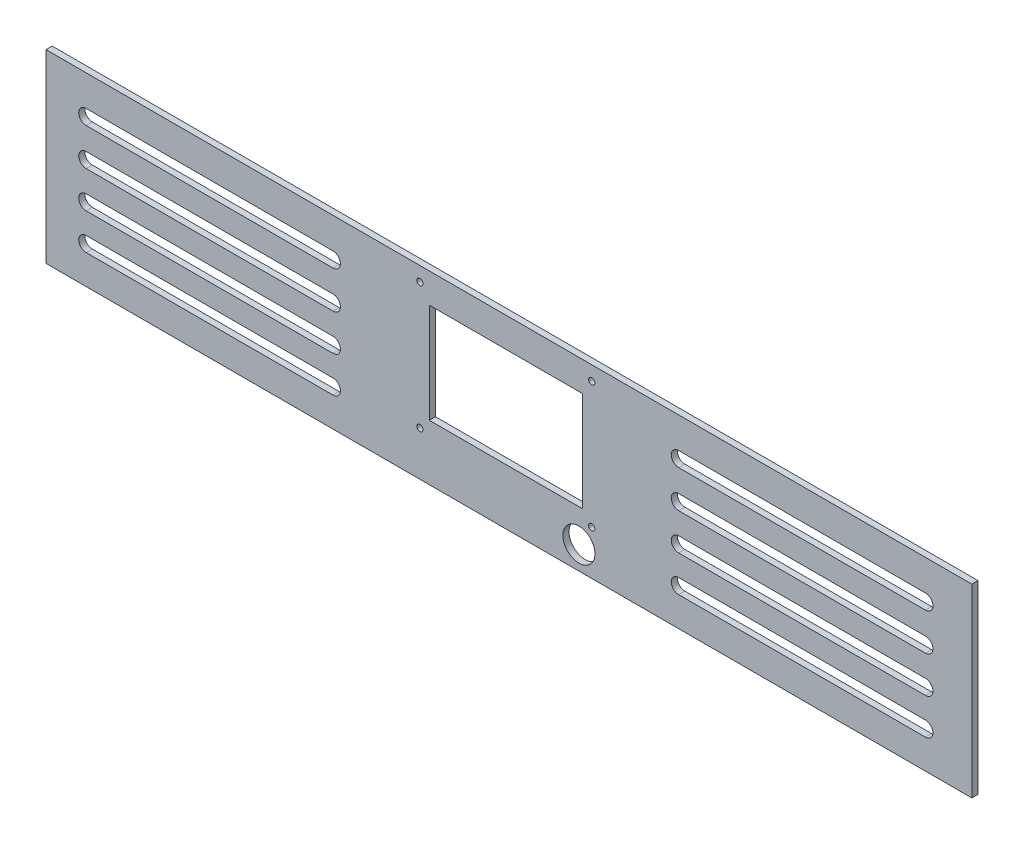
from build123d import *

# Parameters (mm, degrees)
SKETCH1_W           = 473.075
SKETCH1_H           = 95.25
BOSS_EXTRUDE1_DEPTH = 3.175
SKETCH3_W           = 78.74
SKETCH3_H           = 51.308
CUT_EXTRUDE2_DEPTH  = 242.305221983
SKETCH4_R           = 8.255
CUT_EXTRUDE3_DEPTH  = 242.305221983
SKETCH5_R           = 1.5875
CUT_EXTRUDE4_DEPTH  = 242.305221983
SKETCH6_W           = 3.175
SKETCH6_H           = 95.25
BOSS_EXTRUDE2_DEPTH = 371.948016105
SKETCH7_R           = 3.81
SKETCH7_W           = 50.8
SKETCH7_H           = 73.025
CUT_EXTRUDE5_DEPTH  = 381
CUT_EXTRUDE6_DEPTH  = 381
SKETCH12_W          = 371.948016105
SKETCH12_H          = 95.25
CUT_EXTRUDE7_DEPTH  = 54.356
SKETCH13_W          = 3.175
SKETCH13_H          = 95.25
BOSS_EXTRUDE3_DEPTH = 3.175


with BuildPart() as part:
    # Sketch1 → Boss-Extrude1 (new body)
    with BuildSketch(Plane.XY):
        Rectangle(SKETCH1_W, SKETCH1_H)
    extrude(amount=BOSS_EXTRUDE1_DEPTH)

    # Sketch3 → Cut-Extrude2 (cut, through all)
    with BuildSketch(Plane.XY.offset(3.175)):
        with Locations((0, 6.731)):
            Rectangle(SKETCH3_W, SKETCH3_H)
    extrude(amount=-CUT_EXTRUDE2_DEPTH, mode=Mode.SUBTRACT)

    # Sketch4 → Cut-Extrude3 (cut, through all)
    with BuildSketch(Plane.XY.offset(3.175)):
        with Locations((37.592, -35.814)):
            Circle(SKETCH4_R)
    extrude(amount=-CUT_EXTRUDE3_DEPTH, mode=Mode.SUBTRACT)

    # Sketch5 → Cut-Extrude4 (cut, through all)
    with BuildSketch(Plane.XY.offset(3.175)):
        with Locations((44.196, 40.259)):
            Circle(SKETCH5_R)
        with Locations((44.196, -24.765)):
            Circle(SKETCH5_R)
        with Locations((-44.196, -24.765)):
            Circle(SKETCH5_R)
        with Locations((-44.196, 40.259)):
            Circle(SKETCH5_R)
    extrude(amount=-CUT_EXTRUDE4_DEPTH, mode=Mode.SUBTRACT)

    # Sketch6 → Boss-Extrude2 (add)
    with BuildSketch(Plane(origin=(0, 0, 0), x_dir=(-1, 0, 0), z_dir=(0, 0, -1))):
        with Locations((234.95, 0)):
            Rectangle(SKETCH6_W, SKETCH6_H)
    extrude(amount=BOSS_EXTRUDE2_DEPTH)

    # Sketch7 → Cut-Extrude5 (cut)
    with BuildSketch(Plane.ZY.offset(236.5375)):
        with Locations((-248.250016105, -28.575)):
            Circle(SKETCH7_R)
        with Locations((-308.448016105, -7.9375)):
            Rectangle(SKETCH7_W, SKETCH7_H)
    extrude(amount=-CUT_EXTRUDE5_DEPTH, mode=Mode.SUBTRACT)

    # Sketch8 → Cut-Extrude6 (cut)
    with BuildSketch(Plane.XY.offset(3.175)):
        with BuildLine():
            Line((215.9, 31.75), (88.9, 31.75))
            ThreePointArc((88.9, 31.75), (85.09, 27.94), (88.9, 24.13))
            Line((88.9, 24.13), (215.9, 24.13))
            ThreePointArc((215.9, 24.13), (219.71, 27.94), (215.9, 31.75))
        make_face()
        with BuildLine():
            Line((215.9, 12.563594852), (88.9, 12.563594852))
            ThreePointArc((88.9, 12.563594852), (85.09, 8.753594852), (88.9, 4.943594852))
            Line((88.9, 4.943594852), (215.9, 4.943594852))
            ThreePointArc((215.9, 4.943594852), (219.71, 8.753594852), (215.9, 12.563594852))
        make_face()
        with BuildLine():
            Line((215.9, -6.256272006), (88.9, -6.256272006))
            ThreePointArc((88.9, -6.256272006), (85.09, -10.066272006), (88.9, -13.876272006))
            Line((88.9, -13.876272006), (215.9, -13.876272006))
            ThreePointArc((215.9, -13.876272006), (219.71, -10.066272006), (215.9, -6.256272006))
        make_face()
        with BuildLine():
            Line((215.9, -24.84600572), (88.9, -24.84600572))
            ThreePointArc((88.9, -24.84600572), (85.09, -28.65600572), (88.9, -32.46600572))
            Line((88.9, -32.46600572), (215.9, -32.46600572))
            ThreePointArc((215.9, -32.46600572), (219.71, -28.65600572), (215.9, -24.84600572))
        make_face()
        with BuildLine():
            ThreePointArc((-88.9, -32.46600572), (-85.09, -28.65600572), (-88.9, -24.84600572))
            Line((-88.9, -24.84600572), (-215.9, -24.84600572))
            ThreePointArc((-215.9, -24.84600572), (-219.71, -28.65600572), (-215.9, -32.46600572))
            Line((-215.9, -32.46600572), (-88.9, -32.46600572))
        make_face()
        with BuildLine():
            ThreePointArc((-88.9, -13.876272006), (-85.09, -10.066272006), (-88.9, -6.256272006))
            Line((-88.9, -6.256272006), (-215.9, -6.256272006))
            ThreePointArc((-215.9, -6.256272006), (-219.71, -10.066272006), (-215.9, -13.876272006))
            Line((-215.9, -13.876272006), (-88.9, -13.876272006))
        make_face()
        with BuildLine():
            ThreePointArc((-88.9, 4.943594852), (-85.09, 8.753594852), (-88.9, 12.563594852))
            Line((-88.9, 12.563594852), (-215.9, 12.563594852))
            ThreePointArc((-215.9, 12.563594852), (-219.71, 8.753594852), (-215.9, 4.943594852))
            Line((-215.9, 4.943594852), (-88.9, 4.943594852))
        make_face()
        with BuildLine():
            ThreePointArc((-88.9, 24.13), (-85.09, 27.94), (-88.9, 31.75))
            Line((-88.9, 31.75), (-215.9, 31.75))
            ThreePointArc((-215.9, 31.75), (-219.71, 27.94), (-215.9, 24.13))
            Line((-215.9, 24.13), (-88.9, 24.13))
        make_face()
    extrude(amount=-CUT_EXTRUDE6_DEPTH, mode=Mode.SUBTRACT)

    # Sketch12 → Cut-Extrude7 (cut)
    with BuildSketch(Plane(origin=(-233.3625, 0, 0), x_dir=(0, 0, -1), z_dir=(1, 0, 0))):
        with Locations((185.974008053, 0)):
            Rectangle(SKETCH12_W, SKETCH12_H)
    extrude(amount=-CUT_EXTRUDE7_DEPTH, mode=Mode.SUBTRACT)

    # Sketch13 → Boss-Extrude3 (add)
    with BuildSketch(Plane(origin=(236.5375, 0, 0), x_dir=(0, 0, -1), z_dir=(1, 0, 0))):
        with Locations((-1.5875, 0)):
            Rectangle(SKETCH13_W, SKETCH13_H)
    extrude(amount=BOSS_EXTRUDE3_DEPTH)


solid = part.part
